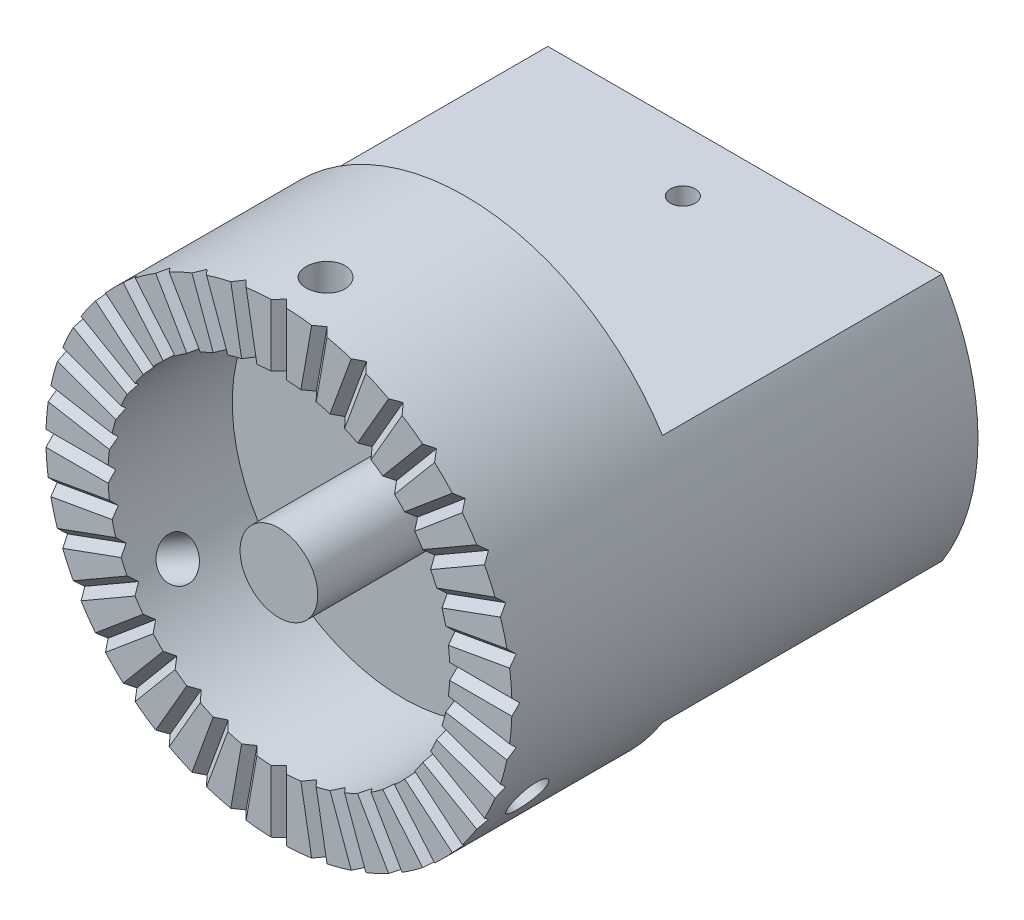
from build123d import *

# Parameters (mm, degrees)
SKETCH2_R                  = 15
CORE_DEPTH                 = 30
SKETCH4_W                  = 25.37715508
SKETCH4_H                  = 25.947890668
FLAT_DEPTH                 = 18
SKETCH9_R                  = 11
CUT_EXTRUDE4_DEPTH         = 8
CUT_EXTRUDE5_DEPTH         = 37.742346142
CIRPATTERN2_COUNT          = 36
M3X0_5_TAPPED_HOLE2_REACH  = 45.058
M3X0_5_TAPPED_HOLE2_BORE_R = 1.25
CIRPATTERN3_COUNT          = 3
SKETCH32_R                 = 2.5
BOSS_EXTRUDE1_DEPTH        = 8
M2X0_4_TAPPED_HOLE2_D      = 1.6
LPATTERN3_COUNT            = 2
LPATTERN3_PITCH            = 10


with BuildPart() as part:
    # Sketch2 → Core (new body)
    with BuildSketch(Plane.XY):
        Circle(SKETCH2_R)
    extrude(amount=CORE_DEPTH)

    # Sketch4 → Flat (cut)
    with BuildSketch(Plane(origin=(0, 0, 0), x_dir=(-1, 0, 0), z_dir=(0, 0, -1))):
        with Locations((0, 20.973945334)):
            Rectangle(SKETCH4_W, SKETCH4_H)
    flat = extrude(amount=-FLAT_DEPTH, mode=Mode.SUBTRACT)

    # Mirror2: Flat across plane
    add(flat.mirror(Plane.ZX), mode=Mode.SUBTRACT)

    # Sketch9 → Cut-Extrude4 (cut)
    with BuildSketch(Plane.XY.offset(30)):
        Circle(SKETCH9_R)
    extrude(amount=-CUT_EXTRUDE4_DEPTH, mode=Mode.SUBTRACT)

    # Sketch29 → Cut-Extrude5 (cut, through all)
    with BuildSketch(Plane(origin=(0, 0, 0), x_dir=(1, 0, 0), z_dir=(0, 1, 0))):
        Polygon((-0.5, -30), (0.5, -30), (0, -29.5), align=None)
    cut_extrude5 = extrude(amount=-CUT_EXTRUDE5_DEPTH, mode=Mode.SUBTRACT)

    # CirPattern2: Cut-Extrude5 ×36 about axis
    cirpattern2_axis = Axis((0, 0, 0), (0, 0, 1))
    for i in range(1, CIRPATTERN2_COUNT):
        add(cut_extrude5.rotate(cirpattern2_axis, i * 360 / CIRPATTERN2_COUNT), mode=Mode.SUBTRACT)

    # M3x0.5 Tapped Hole2 bore (on position points) → M3x0.5 Tapped Hole2 (cut, up to next)
    with BuildSketch(Plane(origin=(0, 15, 27), x_dir=(1, 0, 0), z_dir=(0, 1, 0)), mode=Mode.PRIVATE) as m3x0_5_tapped_hole2_sk1:
        Circle(M3X0_5_TAPPED_HOLE2_BORE_R)
    m3x0_5_tapped_hole2_tool1 = extrude(m3x0_5_tapped_hole2_sk1.sketch, amount=-M3X0_5_TAPPED_HOLE2_REACH, mode=Mode.PRIVATE) & part.part
    m3x0_5_tapped_hole2 = m3x0_5_tapped_hole2_tool1.solids().sort_by_distance((0, 15, 27))[0]
    add(m3x0_5_tapped_hole2, mode=Mode.SUBTRACT)

    # CirPattern3: M3x0.5 Tapped Hole2 ×3 about axis
    cirpattern3_axis = Axis((0, 0, 30), (0, 0, -1))
    for i in range(1, CIRPATTERN3_COUNT):
        add(m3x0_5_tapped_hole2.rotate(cirpattern3_axis, i * 360 / CIRPATTERN3_COUNT), mode=Mode.SUBTRACT)

    # Sketch32 → Boss-Extrude1 (add)
    with BuildSketch(Plane.XY.offset(22)):
        Circle(SKETCH32_R)
    extrude(amount=BOSS_EXTRUDE1_DEPTH)

    # M2x0.4 Tapped Hole2 (through all)
    with Locations(Plane(origin=(0, -8, 0), x_dir=(-1, 0, 0), z_dir=(0, -1, 0))):
        with Locations((0, -4)):
            m2x0_4_tapped_hole2 = Hole(M2X0_4_TAPPED_HOLE2_D / 2)

    # LPattern3: M2x0.4 Tapped Hole2 ×2
    with Locations(*[(0, 0, i * LPATTERN3_PITCH) for i in range(1, LPATTERN3_COUNT)]):
        add(m2x0_4_tapped_hole2, mode=Mode.SUBTRACT)


solid = part.part
